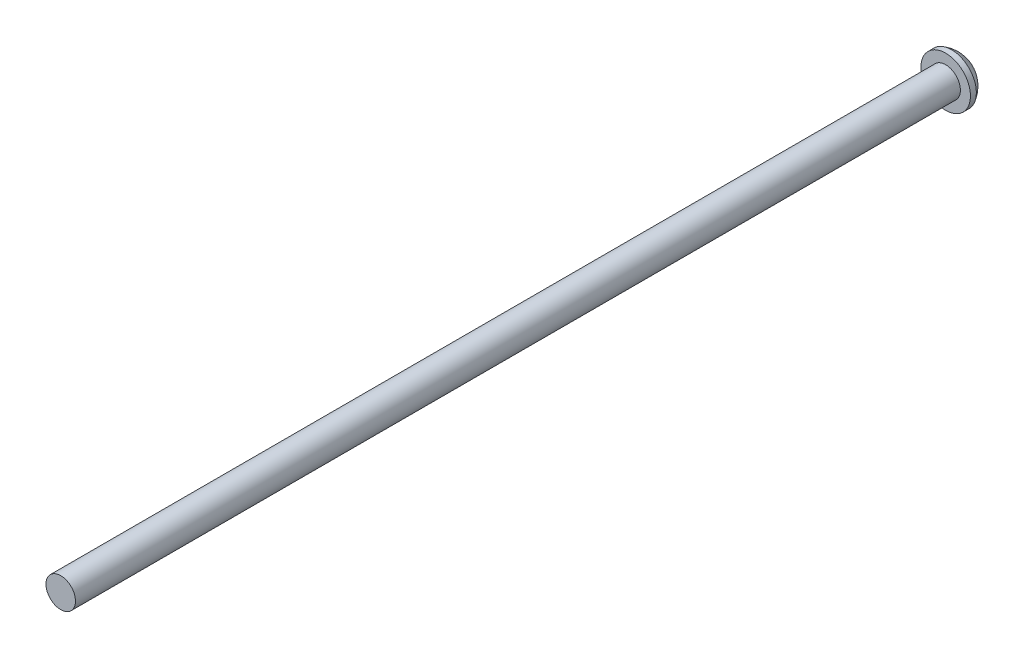
from build123d import *

# Parameters (mm, degrees)
SKETCH1_R           = 0.5
BOSS_EXTRUDE1_DEPTH = 30
SKETCH2_R           = 0.840836639
BOSS_EXTRUDE2_DEPTH = 0.2
DOME1_FACE_RADIUS   = 0.840836639
DOME1_HEIGHT        = 0.5
SCALE1_SCALE        = 1.9329
SCALE2_SCALE        = 1.5


with BuildPart() as part:
    # Sketch1 → Boss-Extrude1 (new body)
    with BuildSketch(Plane.XY):
        Circle(SKETCH1_R)
    extrude(amount=BOSS_EXTRUDE1_DEPTH)

    # Sketch2 → Boss-Extrude2 (add)
    with BuildSketch(Plane(origin=(0, 0, 0), x_dir=(-1, 0, 0), z_dir=(0, 0, -1))):
        Circle(SKETCH2_R)
    extrude(amount=BOSS_EXTRUDE2_DEPTH)

    # Dome1: a dome of height H over a round flat face of radius A is a cap of a sphere of radius (A * A + H * H) / (2 * H)
    dome1_r = (DOME1_FACE_RADIUS * DOME1_FACE_RADIUS + DOME1_HEIGHT * DOME1_HEIGHT) / (2 * DOME1_HEIGHT)
    dome1_base = Plane((0, 0, -0.2), z_dir=(0, 0, -1))
    with Locations(dome1_base.offset(DOME1_HEIGHT - dome1_r)):
        dome1_ball = Sphere(dome1_r, mode=Mode.PRIVATE)
    add(split(dome1_ball, bisect_by=dome1_base, keep=Keep.TOP, mode=Mode.PRIVATE))


with BuildPart() as part_1:
    # Scale1: scaled about (0, 0, 14.340078406)
    add(part.part.scale(SCALE1_SCALE).moved(Location((0, 0, -13.377859145))))


with BuildPart() as part_2:
    # Scale2: scaled about (0, 0, 14.340078406)
    add(part_1.part.scale(SCALE2_SCALE).moved(Location((0, 0, -7.170039203))))


solid = part_2.part
